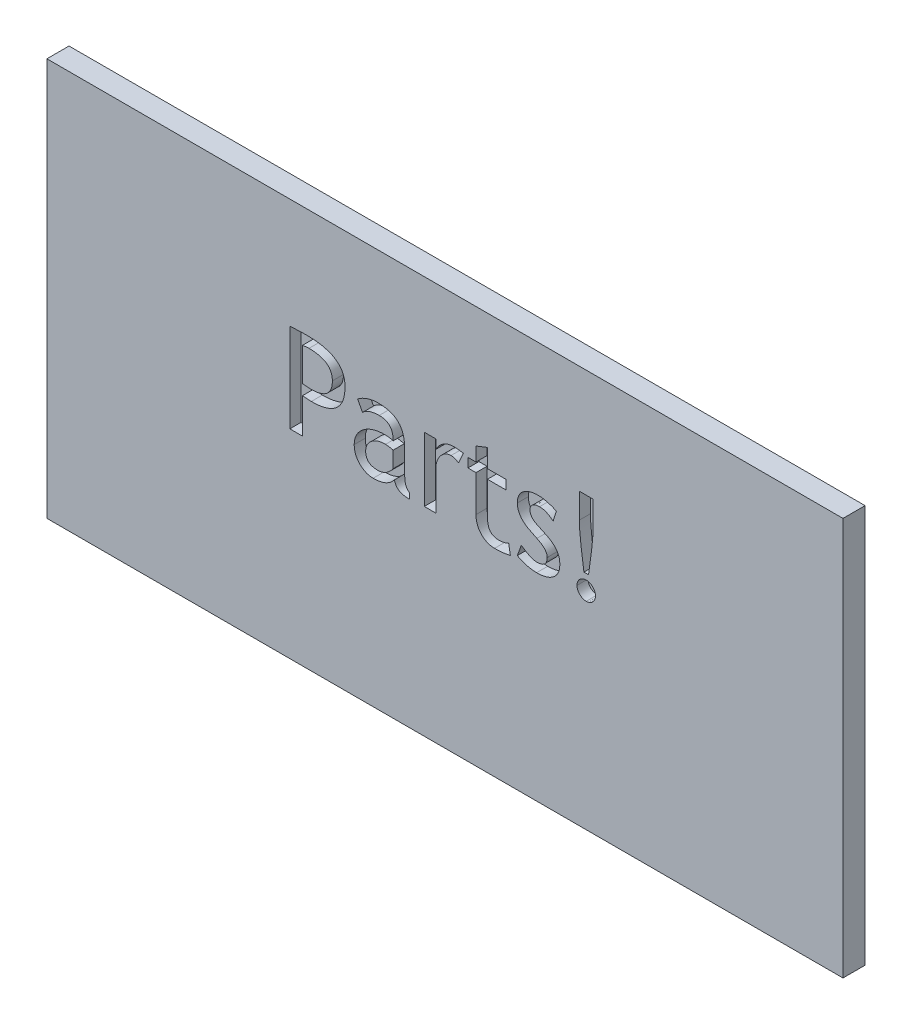
from build123d import *

# Parameters (mm, degrees)
SKETCH1_W           = 914.4
SKETCH1_H           = 457.2
BOSS_EXTRUDE1_DEPTH = 25.4
CUT_EXTRUDE1_DEPTH  = 12.7


with BuildPart() as part:
    # Sketch1 → Boss-Extrude1 (new body)
    with BuildSketch(Plane.XY):
        Rectangle(SKETCH1_W, SKETCH1_H)
    extrude(amount=BOSS_EXTRUDE1_DEPTH)

    # Sketch2 → Cut-Extrude1 (cut)
    # profile 1 of 7: a face of its own
    with BuildSketch(Plane.XY.offset(25.4)):
        with BuildLine():
            Line((-163.615584416, 40.28538961), (-163.615584416, 0))
            Line((-163.615584416, 0), (-178.12987013, 0))
            Line((-178.12987013, 0), (-178.12987013, 102.218506494))
            add(Edge.make_bspline(
                [(-178.12987013, 102.218506494), (-176.879121954, 102.27366981), (-174.508247341, 102.37823547), (-171.15458288, 102.523319863), (-168.192539103, 102.643966244), (-165.62295261, 102.760663715), (-163.436517225, 102.803198457), (-161.643762274, 102.885891383), (-160.241181936, 102.893415534), (-159.437211969, 102.911786323), (-159.100487013, 102.919480519)],
                knots=[0, 0, 0, 0, 1.577853808, 2.99092464, 4.230560714, 5.314071883, 6.232522799, 6.986491855, 7.575514634, 8, 8, 8, 8], degree=3))
            add(Edge.make_bspline(
                [(-159.100487013, 102.919480519), (-157.313276247, 102.892987063), (-153.845682191, 102.841583752), (-148.819918078, 102.52538382), (-144.139820894, 101.946365157), (-139.804976334, 101.155792858), (-135.808587288, 100.123633049), (-132.145402028, 98.890327417), (-128.851053451, 97.364924482), (-125.869313516, 95.6695841), (-123.263927259, 93.695397743), (-120.975749497, 91.521033581), (-119.072883939, 89.07938071), (-117.482589102, 86.429697125), (-116.290131415, 83.525560622), (-115.426730076, 80.404765136), (-114.872736968, 77.058039718), (-114.821196948, 74.745305359), (-114.794805195, 73.561038961)],
                knots=[0, 0, 0, 0, 1.423919344, 2.762726338, 4.009571971, 5.179014362, 6.27060433, 7.295643458, 8.253560935, 9.158834423, 10.022816685, 10.851466544, 11.666382283, 12.481426763, 13.306069473, 14.158929247, 15.057255227, 16, 16, 16, 16], degree=3))
            add(Edge.make_bspline(
                [(-114.794805195, 73.561038961), (-114.818935661, 72.185251497), (-114.865650066, 69.521851183), (-115.327152429, 65.657299221), (-116.084859429, 62.06147442), (-117.129494616, 58.717850878), (-118.491687817, 55.640846292), (-120.18110912, 52.840467459), (-122.13638298, 50.278094722), (-124.441297825, 48.016967471), (-127.02223831, 46.005911574), (-129.927117107, 44.291130049), (-133.111578317, 42.826777099), (-136.600450006, 41.632330534), (-140.38958188, 40.708602079), (-144.486429512, 40.068271998), (-148.879107442, 39.638041367), (-151.910971039, 39.602642477), (-153.472077922, 39.584415584)],
                knots=[0, 0, 0, 0, 1.119012572, 2.166307307, 3.161006299, 4.105347886, 5.011469497, 5.891793109, 6.760820887, 7.626730921, 8.511447675, 9.416706231, 10.364930173, 11.358732919, 12.412486159, 13.53399667, 14.730254627, 16, 16, 16, 16], degree=3))
            add(Edge.make_bspline(
                [(-153.472077922, 39.584415584), (-153.691964193, 39.592067692), (-154.19352603, 39.609522192), (-155.032963235, 39.618355651), (-156.042620907, 39.691147587), (-157.223730047, 39.778869028), (-158.579543416, 39.847101998), (-160.103946042, 39.982208595), (-161.801549778, 40.12428583), (-162.990249649, 40.229853849), (-163.615584416, 40.28538961)],
                knots=[0, 0, 0, 0, 0.519235843, 1.184379918, 1.980559897, 2.90727091, 3.979636347, 5.183721872, 6.518451402, 8, 8, 8, 8], degree=3))
        make_face()
        with BuildLine():
            Line((-163.615584416, 90.343181818), (-163.615584416, 52.160714286))
            add(Edge.make_bspline(
                [(-163.615584416, 52.160714286), (-162.942124492, 52.105403661), (-161.677680481, 52.001556074), (-159.904358583, 51.860872212), (-158.38686254, 51.726702403), (-157.120471946, 51.655764481), (-156.110819631, 51.573549935), (-155.356221419, 51.496243058), (-154.852799353, 51.490128885), (-154.605960777, 51.467347265), (-154.523538961, 51.45974026)],
                knots=[0, 0, 0, 0, 1.77832381, 3.338863697, 4.681619775, 5.787235154, 6.676397059, 7.347775098, 7.782215722, 8, 8, 8, 8], degree=3))
            add(Edge.make_bspline(
                [(-154.523538961, 51.45974026), (-153.505781104, 51.473837586), (-151.528950848, 51.501219365), (-148.666606474, 51.76131145), (-145.993920741, 52.128351351), (-143.531776821, 52.720940223), (-141.254063638, 53.425951628), (-139.176302361, 54.320450336), (-137.2869354, 55.364755628), (-135.610665044, 56.597519681), (-134.096956846, 57.957063005), (-132.825810462, 59.523362551), (-131.715287627, 61.221807967), (-130.826352633, 63.095414719), (-130.151817599, 65.133719784), (-129.654614586, 67.328414073), (-129.370578205, 69.684506294), (-129.329945249, 71.30617403), (-129.309090909, 72.138474026)],
                knots=[0, 0, 0, 0, 1.309170541, 2.542852328, 3.695843429, 4.776838986, 5.797565881, 6.760101477, 7.682524874, 8.56863165, 9.432306229, 10.292760922, 11.15611858, 12.038112649, 12.952490574, 13.913522175, 14.929142236, 16, 16, 16, 16], degree=3))
            add(Edge.make_bspline(
                [(-129.309090909, 72.138474026), (-129.32812298, 72.902319017), (-129.365153168, 74.388511723), (-129.674350306, 76.548101113), (-130.207491113, 78.555662071), (-130.961868834, 80.415176566), (-131.904405436, 82.134374452), (-133.076188534, 83.696937466), (-134.450393614, 85.106389727), (-136.027095914, 86.381220077), (-137.84634065, 87.460023602), (-139.845015403, 88.441879602), (-142.078743908, 89.231649287), (-144.499954676, 89.916486475), (-147.142802925, 90.42179269), (-149.985429933, 90.794633553), (-153.043327633, 90.988585893), (-155.148687877, 91.025245135), (-156.23474026, 91.044155844)],
                knots=[0, 0, 0, 0, 0.979831033, 1.906430954, 2.792007294, 3.638616229, 4.475432108, 5.300832925, 6.136486397, 6.995858543, 7.894207126, 8.844710668, 9.848998133, 10.929490732, 12.070915545, 13.298158202, 14.606251956, 16, 16, 16, 16], degree=3))
            add(Edge.make_bspline(
                [(-156.23474026, 91.044155844), (-156.72282765, 91.034420997), (-157.789612221, 91.0131441), (-159.50999624, 90.885895992), (-161.481339755, 90.648029815), (-162.87377707, 90.449138969), (-163.615584416, 90.343181818)],
                knots=[0, 0, 0, 0, 0.789391293, 1.725327202, 2.78819034, 4, 4, 4, 4], degree=3))
        make_face(mode=Mode.SUBTRACT)
    # profile 2 of 7: a face of its own
    with BuildSketch(Plane.XY.offset(25.4)):
        with BuildLine():
            add(Edge.make_bspline(
                [(-58.118993506, 9.236363636), (-58.804551384, 8.390969175), (-60.165490115, 6.712730031), (-62.59368798, 4.570272111), (-65.256561347, 2.724521622), (-68.204932545, 1.24720517), (-71.408244512, 0.084420221), (-74.874587923, -0.729903565), (-78.604283679, -1.232709137), (-81.180751079, -1.289967336), (-82.508766234, -1.319480519)],
                knots=[0, 0, 0, 0, 0.944960127, 1.875892434, 2.804059133, 3.755402226, 4.734562172, 5.760675535, 6.845761903, 8, 8, 8, 8], degree=3))
            add(Edge.make_bspline(
                [(-82.508766234, -1.319480519), (-83.231683627, -1.301068723), (-84.656810028, -1.264772546), (-86.75281686, -0.934313597), (-88.791553228, -0.454753314), (-90.745523747, 0.281848663), (-92.638957142, 1.184543132), (-94.434505951, 2.318025602), (-96.184392827, 3.613506596), (-97.808851863, 5.132738767), (-99.309136558, 6.792379574), (-100.63834414, 8.56718545), (-101.751324783, 10.450090656), (-102.674009449, 12.428460625), (-103.370357091, 14.512177049), (-103.857745603, 16.689146984), (-104.185321253, 18.957676716), (-104.220814083, 20.505739025), (-104.238961039, 21.29724026)],
                knots=[0, 0, 0, 0, 0.993455545, 1.95845298, 2.911997968, 3.868815737, 4.82409202, 5.79181603, 6.784147119, 7.814064514, 8.844588789, 9.85771863, 10.857760396, 11.847207058, 12.854368548, 13.872291747, 14.912134415, 16, 16, 16, 16], degree=3))
            add(Edge.make_bspline(
                [(-104.238961039, 21.29724026), (-104.204429156, 22.247205575), (-104.136467287, 24.11682322), (-103.683103321, 26.863477775), (-102.880315854, 29.487511837), (-101.79723299, 32.008470584), (-100.362301544, 34.402853971), (-98.651113542, 36.697720435), (-96.613300063, 38.869809881), (-94.284659654, 40.894518554), (-91.737468724, 42.764221485), (-88.965030253, 44.373960211), (-86.040699138, 45.766893377), (-82.924878614, 46.866845909), (-79.663198779, 47.768383511), (-76.218240764, 48.373318152), (-72.607546914, 48.753730633), (-70.139627112, 48.798133891), (-68.881006494, 48.820779221)],
                knots=[0, 0, 0, 0, 0.914144162, 1.799118376, 2.669442492, 3.549088249, 4.432603435, 5.349184236, 6.299014847, 7.292526244, 8.315019686, 9.334664862, 10.373010545, 11.427301971, 12.510180587, 13.625743326, 14.789146875, 16, 16, 16, 16], degree=3))
            add(Edge.make_bspline(
                [(-68.881006494, 48.820779221), (-68.158778987, 48.803730344), (-66.662327883, 48.768405173), (-64.355957833, 48.505277427), (-61.905722307, 48.092013098), (-60.240609357, 47.703097433), (-59.376623377, 47.501298701)],
                knots=[0, 0, 0, 0, 0.901025355, 1.866919186, 2.893197055, 4, 4, 4, 4], degree=3))
            add(Edge.make_bspline(
                [(-59.376623377, 47.501298701), (-59.388317989, 48.195713502), (-59.410941648, 49.539084646), (-59.589926086, 51.492015391), (-59.928846057, 53.300484817), (-60.346792798, 54.99221497), (-60.932575602, 56.53218503), (-61.608923485, 57.959177683), (-62.435468796, 59.239867833), (-63.396703812, 60.382812972), (-64.470244382, 61.411115889), (-65.700674282, 62.263864963), (-67.029118473, 63.028650826), (-68.500541248, 63.607459825), (-70.082165289, 64.09829581), (-71.798998767, 64.409821101), (-73.637854508, 64.628364356), (-74.907291553, 64.645647182), (-75.560876623, 64.654545455)],
                knots=[0, 0, 0, 0, 1.232010569, 2.38337006, 3.473922505, 4.494186629, 5.47029199, 6.391873334, 7.29149648, 8.165725792, 9.03688882, 9.919916482, 10.815232808, 11.75034576, 12.71849901, 13.749128771, 14.841111628, 16, 16, 16, 16], degree=3))
            add(Edge.make_bspline(
                [(-75.560876623, 64.654545455), (-76.565066872, 64.635775608), (-78.523454469, 64.599170358), (-81.371158751, 64.285730327), (-84.042515408, 63.777889311), (-86.534748523, 63.053196163), (-88.853438682, 62.130108785), (-90.989719984, 60.989802365), (-92.954492735, 59.647096738), (-94.114023397, 58.586856482), (-94.693344156, 58.057142857)],
                knots=[0, 0, 0, 0, 1.160376748, 2.26298496, 3.306713365, 4.299604534, 5.258357027, 6.185834306, 7.093612716, 8, 8, 8, 8], degree=3))
            Line((-94.693344156, 58.057142857), (-100.280519481, 68.612987013))
            add(Edge.make_bspline(
                [(-100.280519481, 68.612987013), (-99.604560084, 69.151241085), (-98.187463536, 70.279649081), (-95.730855172, 71.719982014), (-92.936257847, 73.058160886), (-89.854459797, 74.249085549), (-86.627709247, 75.232049855), (-83.402298085, 75.993995848), (-80.239806223, 76.440672792), (-78.153033941, 76.500483766), (-77.12775974, 76.52987013)],
                knots=[0, 0, 0, 0, 0.83233406, 1.744923925, 2.737828223, 3.818310257, 4.927193929, 5.988133053, 7.011528333, 8, 8, 8, 8], degree=3))
            add(Edge.make_bspline(
                [(-77.12775974, 76.52987013), (-75.821220001, 76.506088641), (-73.292543573, 76.460061957), (-69.640236163, 76.109067041), (-66.262081502, 75.536718743), (-63.155220697, 74.74894727), (-60.33158665, 73.689788386), (-57.779087165, 72.41735598), (-55.499383213, 70.901277266), (-53.501125459, 69.126921781), (-51.746238523, 67.108047962), (-50.256869132, 64.801680846), (-48.978860678, 62.245660354), (-47.948100595, 59.407307568), (-47.151228706, 56.299483354), (-46.579661025, 52.920771617), (-46.257603101, 49.266844882), (-46.207686236, 46.745979905), (-46.181818182, 45.43961039)],
                knots=[0, 0, 0, 0, 1.2352911, 2.390781845, 3.465517746, 4.472669273, 5.416533714, 6.311624893, 7.164115709, 7.997342812, 8.831177852, 9.685499483, 10.586398193, 11.528000591, 12.535152118, 13.616293066, 14.7647089, 16, 16, 16, 16], degree=3))
            Line((-46.181818182, 45.43961039), (-46.181818182, 18.472727273))
            add(Edge.make_bspline(
                [(-46.181818182, 18.472727273), (-46.167425523, 17.68170691), (-46.139814194, 16.164188559), (-45.891867346, 13.990529498), (-45.487670896, 12.019937146), (-44.913976057, 10.252497442), (-44.172719466, 8.68676798), (-43.257490454, 7.330413377), (-42.18056334, 6.165442541), (-41.328150505, 5.572857556), (-40.903896104, 5.277922078)],
                knots=[0, 0, 0, 0, 1.279077697, 2.453822896, 3.53296146, 4.527738333, 5.452481132, 6.324974507, 7.166323045, 8, 8, 8, 8], degree=3))
            Line((-40.903896104, 5.277922078), (-40.903896104, -1.319480519))
            add(Edge.make_bspline(
                [(-40.903896104, -1.319480519), (-42.122347332, -1.300488782), (-44.405038252, -1.26490897), (-47.586998347, -0.783427919), (-50.303387249, -0.055114176), (-52.579706693, 1.031701533), (-54.448080018, 2.52115413), (-55.986140704, 4.392931156), (-57.234045055, 6.665802136), (-57.814886365, 8.353005845), (-58.118993506, 9.236363636)],
                knots=[0, 0, 0, 0, 1.322927942, 2.4784214, 3.487862418, 4.369631662, 5.198919122, 6.063344162, 6.986038252, 8, 8, 8, 8], degree=3))
        make_face()
        with BuildLine():
            add(Edge.make_bspline(
                [(-59.376623377, 38.264935065), (-60.344438217, 38.463975843), (-62.12465354, 38.830094885), (-64.565832411, 39.237315236), (-66.53819186, 39.517594636), (-67.698357811, 39.564226438), (-68.200649351, 39.584415584)],
                knots=[0, 0, 0, 0, 1.327096202, 2.441083662, 3.325070274, 4, 4, 4, 4], degree=3))
            add(Edge.make_bspline(
                [(-68.200649351, 39.584415584), (-69.025818615, 39.568594706), (-70.638792166, 39.537669343), (-72.99959102, 39.295794724), (-75.234306128, 38.84788), (-77.368361767, 38.289153687), (-79.37288598, 37.516022334), (-81.270109384, 36.587168638), (-83.035032735, 35.467452743), (-84.685316595, 34.220702948), (-86.15598966, 32.839923583), (-87.4676748, 31.402348598), (-88.564970216, 29.883010247), (-89.484334452, 28.31450051), (-90.185864059, 26.678893076), (-90.691350443, 24.985226983), (-90.980579217, 23.22457312), (-91.022802393, 22.026726419), (-91.044155844, 21.420941558)],
                knots=[0, 0, 0, 0, 1.220287638, 2.385318708, 3.503525747, 4.58834872, 5.643485871, 6.675260618, 7.707335663, 8.72980793, 9.729394515, 10.686538231, 11.60338903, 12.495920083, 13.370033194, 14.228646617, 15.104176635, 16, 16, 16, 16], degree=3))
            add(Edge.make_bspline(
                [(-91.044155844, 21.420941558), (-91.014091567, 20.461000685), (-90.957234776, 18.645585057), (-90.282288006, 16.119705818), (-89.202005669, 13.960908326), (-87.645025398, 12.19826576), (-85.648576215, 10.830451172), (-83.21334697, 9.898407439), (-80.371137433, 9.318332195), (-78.333569516, 9.264795711), (-77.251461039, 9.236363636)],
                knots=[0, 0, 0, 0, 1.090937083, 2.063152309, 2.952441297, 3.817735852, 4.712383707, 5.68197955, 6.768949218, 8, 8, 8, 8], degree=3))
            add(Edge.make_bspline(
                [(-77.251461039, 9.236363636), (-76.417349907, 9.26722146), (-74.761701466, 9.328471941), (-72.320547691, 9.848664269), (-69.955343377, 10.674696447), (-67.670211969, 11.844750781), (-65.470036358, 13.350764384), (-63.343589508, 15.183496931), (-61.269300397, 17.329742072), (-60.020643334, 18.954306211), (-59.376623377, 19.792207792)],
                knots=[0, 0, 0, 0, 0.926994493, 1.840014991, 2.763567446, 3.707150477, 4.686710869, 5.722325487, 6.825243626, 8, 8, 8, 8], degree=3))
            Line((-59.376623377, 19.792207792), (-59.376623377, 38.264935065))
        make_face(mode=Mode.SUBTRACT)
    # profile 3 of 7: a face of its own
    with BuildSketch(Plane.XY.offset(25.4)):
        with BuildLine():
            add(Edge.make_bspline(
                [(15.627597403, 62.984577922), (14.916713947, 63.436825565), (13.540321602, 64.3124546), (11.359035639, 65.272302654), (9.157720528, 65.864537515), (7.679833926, 65.937761003), (6.94788961, 65.974025974)],
                knots=[0, 0, 0, 0, 1.083912525, 2.09864063, 3.058324786, 4, 4, 4, 4], degree=3))
            add(Edge.make_bspline(
                [(6.94788961, 65.974025974), (6.36921217, 65.954702119), (5.224039598, 65.916461213), (3.540216147, 65.595839065), (1.914036887, 65.074458614), (0.342524355, 64.348094121), (-1.179846885, 63.414795684), (-2.615043829, 62.239099042), (-4.029181872, 60.900797622), (-5.346897659, 59.357628343), (-6.589092907, 57.693052931), (-7.621149118, 55.884259357), (-8.557604206, 54.026728353), (-9.256667271, 52.058948912), (-9.852236444, 50.025433519), (-10.254841036, 47.898920512), (-10.510709472, 45.68642947), (-10.540644109, 44.18270756), (-10.555844156, 43.419155844)],
                knots=[0, 0, 0, 0, 0.879821936, 1.741121875, 2.597521335, 3.47235911, 4.368980926, 5.306256831, 6.289802627, 7.327487782, 8.389847235, 9.44425347, 10.491690238, 11.550235473, 12.6158827, 13.712920077, 14.838679022, 16, 16, 16, 16], degree=3))
            Line((-10.555844156, 43.419155844), (-10.555844156, 0))
            Line((-10.555844156, 0), (-23.750649351, 0))
            Line((-23.750649351, 0), (-23.750649351, 73.890909091))
            Line((-23.750649351, 73.890909091), (-10.555844156, 73.890909091))
            Line((-10.555844156, 73.890909091), (-10.555844156, 63.335064935))
            add(Edge.make_bspline(
                [(-10.555844156, 63.335064935), (-9.94103353, 64.381923602), (-8.74845061, 66.412574527), (-6.602581655, 69.118459497), (-4.238577006, 71.41612363), (-1.635412372, 73.295158581), (1.195071073, 74.749881333), (4.243496136, 75.785980772), (7.505954358, 76.418514239), (9.755774054, 76.492191567), (10.906331169, 76.52987013)],
                knots=[0, 0, 0, 0, 1.095181229, 2.124384928, 3.107413611, 4.063213658, 5.012363421, 5.969994755, 6.961855929, 8, 8, 8, 8], degree=3))
            add(Edge.make_bspline(
                [(10.906331169, 76.52987013), (11.559437719, 76.507485588), (13.005427831, 76.457925795), (15.368484782, 76.253763728), (18.112872348, 75.835075703), (20.067592488, 75.508518462), (21.111688312, 75.334090909)],
                knots=[0, 0, 0, 0, 0.762334318, 1.687822431, 2.764971572, 4, 4, 4, 4], degree=3))
            Line((21.111688312, 75.334090909), (15.627597403, 62.984577922))
        make_face()
    # profile 4 of 7: a face of its own
    with BuildSketch(Plane.XY.offset(25.4)):
        with BuildLine():
            Line((35.625974026, 63.335064935), (26.38961039, 63.335064935))
            Line((26.38961039, 63.335064935), (26.38961039, 73.890909091))
            Line((26.38961039, 73.890909091), (35.625974026, 73.890909091))
            Line((35.625974026, 73.890909091), (35.625974026, 89.807142857))
            Line((35.625974026, 89.807142857), (48.820779221, 95.002597403))
            Line((48.820779221, 95.002597403), (48.820779221, 73.890909091))
            Line((48.820779221, 73.890909091), (69.932467532, 73.890909091))
            Line((69.932467532, 73.890909091), (69.932467532, 63.335064935))
            Line((69.932467532, 63.335064935), (48.820779221, 63.335064935))
            Line((48.820779221, 63.335064935), (48.820779221, 26.492694805))
            add(Edge.make_bspline(
                [(48.820779221, 26.492694805), (48.824122793, 25.743183194), (48.830604293, 24.290258195), (49.009242716, 22.19967183), (49.241285489, 20.276195739), (49.594995727, 18.525872036), (50.041985685, 16.937381673), (50.590952415, 15.509421522), (51.25458392, 14.255409564), (52.025266257, 13.167688736), (52.905909778, 12.225468378), (53.901412003, 11.402928587), (55.052752124, 10.759962375), (56.295385658, 10.189851131), (57.667561201, 9.761668061), (59.159228331, 9.455979347), (60.77382971, 9.268725989), (61.891362006, 9.247393235), (62.469155844, 9.236363636)],
                knots=[0, 0, 0, 0, 1.412375387, 2.737883543, 3.952723546, 5.06303916, 6.100522586, 7.060446298, 7.941412932, 8.768226801, 9.565694039, 10.366940763, 11.191315048, 12.043716813, 12.941012141, 13.893828134, 14.911053281, 16, 16, 16, 16], degree=3))
            add(Edge.make_bspline(
                [(62.469155844, 9.236363636), (63.344323237, 9.268657108), (65.12190543, 9.334249474), (67.802788191, 9.865429156), (70.532443931, 10.675870268), (72.304494302, 11.469525197), (73.210551948, 11.875324675)],
                knots=[0, 0, 0, 0, 0.941382402, 1.912073746, 2.932433537, 4, 4, 4, 4], degree=3))
            Line((73.210551948, 11.875324675), (75.21038961, 0.680357143))
            add(Edge.make_bspline(
                [(75.21038961, 0.680357143), (73.790950693, 0.374985539), (70.905062623, -0.245871235), (66.429566841, -0.878372546), (61.754024183, -1.250240075), (58.566390206, -1.296124553), (56.943831169, -1.319480519)],
                knots=[0, 0, 0, 0, 0.94587189, 1.923070004, 2.942807876, 4, 4, 4, 4], degree=3))
            add(Edge.make_bspline(
                [(56.943831169, -1.319480519), (56.207171893, -1.301292583), (54.761497587, -1.26559924), (52.64458109, -0.936216192), (50.604960837, -0.457863303), (48.665018785, 0.281542309), (46.794576518, 1.187486393), (45.015675959, 2.304581365), (43.336705435, 3.63955705), (41.765690366, 5.153675139), (40.320360127, 6.816748017), (39.066518815, 8.608192422), (37.999353464, 10.506165466), (37.137877473, 12.512455255), (36.448482538, 14.621802983), (35.982205555, 16.848205789), (35.687616782, 19.172683972), (35.646713041, 20.760304407), (35.625974026, 21.56525974)],
                knots=[0, 0, 0, 0, 1.011657449, 1.985350936, 2.938256691, 3.885576537, 4.83171868, 5.790782512, 6.765757656, 7.774368669, 8.785452854, 9.788965921, 10.774179575, 11.772479321, 12.784974034, 13.818611436, 14.893992343, 16, 16, 16, 16], degree=3))
            Line((35.625974026, 21.56525974), (35.625974026, 63.335064935))
        make_face()
    # profile 5 of 7: a face of its own
    with BuildSketch(Plane.XY.offset(25.4)):
        with BuildLine():
            Line((83.127272727, 4.556331169), (87.724837662, 17.153246753))
            add(Edge.make_bspline(
                [(87.724837662, 17.153246753), (88.613040508, 16.527062467), (90.319412695, 15.324067615), (92.858304948, 13.714883221), (95.253225878, 12.340073072), (97.523179885, 11.218557615), (99.665385206, 10.344840458), (101.670714679, 9.719435344), (103.542509284, 9.316203285), (104.752619707, 9.262202795), (105.331655844, 9.236363636)],
                knots=[0, 0, 0, 0, 1.332253382, 2.559460521, 3.683996021, 4.716505285, 5.661560423, 6.517070436, 7.290420287, 8, 8, 8, 8], degree=3))
            add(Edge.make_bspline(
                [(105.331655844, 9.236363636), (106.282716885, 9.263041999), (108.069006449, 9.313149489), (110.562412215, 9.80903609), (112.70007765, 10.613094326), (114.436267153, 11.820932304), (115.813563776, 13.351050613), (116.756363607, 15.238555644), (117.353041261, 17.440412186), (117.405811061, 19.018209322), (117.433766234, 19.854058442)],
                knots=[0, 0, 0, 0, 1.237415283, 2.324122124, 3.296572087, 4.190537608, 5.052884192, 5.949713559, 6.91384635, 8, 8, 8, 8], degree=3))
            add(Edge.make_bspline(
                [(117.433766234, 19.854058442), (117.398842306, 20.483750987), (117.329128356, 21.74072172), (116.733096871, 23.575411174), (115.784947701, 25.329335575), (114.464160228, 27.011469633), (112.763690616, 28.594833282), (110.720260619, 30.13091953), (108.296765341, 31.589554588), (106.514460465, 32.451941416), (105.579058442, 32.904545455)],
                knots=[0, 0, 0, 0, 0.810114072, 1.617122017, 2.46134648, 3.37043313, 4.360517749, 5.448424735, 6.660863975, 8, 8, 8, 8], degree=3))
            add(Edge.make_bspline(
                [(105.579058442, 32.904545455), (104.848603359, 33.237106816), (103.443931148, 33.876625541), (101.452808519, 34.86443271), (99.612085107, 35.725438005), (97.991062118, 36.58630921), (96.540065484, 37.34147626), (95.282004136, 38.042662563), (94.206721605, 38.677878943), (92.508136231, 39.784222606), (90.281853656, 41.537677953), (88.121006631, 43.736958297), (86.67282752, 45.638059502), (85.698700399, 47.082729609), (84.935586447, 48.598944143), (84.247448661, 50.127500755), (83.765155609, 51.738812577), (83.385923755, 53.389650418), (83.183243618, 55.110893607), (83.14618491, 56.269891728), (83.127272727, 56.861363636)],
                knots=[0, 0, 0, 0, 1.23709491, 2.378945513, 3.426052076, 4.368942052, 5.207711754, 5.94752138, 6.588849952, 7.132436911, 9.071528894, 10.94447031, 11.866174453, 12.753511042, 13.625345716, 14.47942911, 15.333840934, 16.212854489, 17.08796542, 18, 18, 18, 18], degree=3))
            add(Edge.make_bspline(
                [(83.127272727, 56.861363636), (83.147190158, 57.611301859), (83.186287852, 59.083422241), (83.488975178, 61.231180359), (84.040806298, 63.242238779), (84.745811834, 65.139327048), (85.721068246, 66.884909073), (86.868360627, 68.522105344), (88.249959091, 70.014861848), (89.818774774, 71.377636301), (91.563851417, 72.577335637), (93.440319912, 73.638629205), (95.440572343, 74.558226606), (97.592460857, 75.256109785), (99.851820888, 75.85732299), (102.250591037, 76.223815028), (104.769130509, 76.487578775), (106.492317983, 76.515569259), (107.372727273, 76.52987013)],
                knots=[0, 0, 0, 0, 1.022782438, 2.007710539, 2.949032681, 3.862933841, 4.760636158, 5.668315145, 6.583849215, 7.527362271, 8.497233202, 9.466877628, 10.465273033, 11.4938377, 12.548717365, 13.650528614, 14.799610336, 16, 16, 16, 16], degree=3))
            add(Edge.make_bspline(
                [(107.372727273, 76.52987013), (108.07408837, 76.510542328), (109.528171492, 76.470471342), (111.783260433, 76.244337585), (114.16344182, 75.807200114), (116.690473838, 75.291109703), (119.323441771, 74.54748142), (122.097181065, 73.683436097), (125.005924296, 72.650491413), (126.975144596, 71.863529227), (127.98961039, 71.458116883)],
                knots=[0, 0, 0, 0, 0.788423695, 1.634583945, 2.543753211, 3.507206369, 4.532133891, 5.616758026, 6.772246325, 8, 8, 8, 8], degree=3))
            Line((127.98961039, 71.458116883), (124.278571429, 59.376623377))
            add(Edge.make_bspline(
                [(124.278571429, 59.376623377), (123.639662829, 59.901177832), (122.393559791, 60.924248897), (120.445507278, 62.273160679), (118.490317311, 63.402398494), (116.538745546, 64.349080451), (114.582536805, 65.06730381), (112.624342574, 65.592571912), (110.661445895, 65.913251166), (109.346224755, 65.953841642), (108.692207792, 65.974025974)],
                knots=[0, 0, 0, 0, 1.147535307, 2.238109229, 3.285624631, 4.280117791, 5.246232794, 6.174419652, 7.092197899, 8, 8, 8, 8], degree=3))
            add(Edge.make_bspline(
                [(108.692207792, 65.974025974), (107.94070039, 65.949126789), (106.492878509, 65.901157087), (104.413778266, 65.45282705), (102.513527349, 64.735147807), (100.840519451, 63.727633186), (99.415463193, 62.538765414), (98.398542524, 61.118379465), (97.757665994, 59.544644853), (97.680601469, 58.434182146), (97.641558442, 57.871590909)],
                knots=[0, 0, 0, 0, 1.185623905, 2.284172091, 3.342513114, 4.379428126, 5.356672626, 6.251331621, 7.114076051, 8, 8, 8, 8], degree=3))
            add(Edge.make_bspline(
                [(97.641558442, 57.871590909), (97.662496807, 57.271366578), (97.703645024, 56.091801713), (98.112264057, 54.387309098), (98.753710983, 52.799024712), (99.658888624, 51.328126288), (100.832935045, 49.984932591), (102.245244327, 48.742846842), (103.917586867, 47.617641585), (105.158780098, 46.999089528), (105.805844156, 46.676623377)],
                knots=[0, 0, 0, 0, 0.977472815, 1.920936105, 2.840937217, 3.761757322, 4.723421608, 5.73989644, 6.821753339, 8, 8, 8, 8], degree=3))
            Line((105.805844156, 46.676623377), (115.28961039, 42.223376623))
            add(Edge.make_bspline(
                [(115.28961039, 42.223376623), (116.659141253, 41.565198098), (119.266735843, 40.312022424), (122.745173201, 38.07231076), (125.657130769, 35.719234406), (128.017848789, 33.195897579), (129.797580535, 30.390085222), (131.0687376, 27.29625529), (131.817176926, 23.868437159), (131.903474689, 21.479690464), (131.948051948, 20.245779221)],
                knots=[0, 0, 0, 0, 1.237288181, 2.355803767, 3.362588053, 4.282183816, 5.158430962, 6.054936231, 6.995273942, 8, 8, 8, 8], degree=3))
            add(Edge.make_bspline(
                [(131.948051948, 20.245779221), (131.930371631, 19.426925759), (131.895749927, 17.823441994), (131.562997781, 15.485683859), (130.997093011, 13.285975791), (130.249967195, 11.202414974), (129.217248066, 9.290351647), (128.025745091, 7.481533243), (126.556365931, 5.859208989), (124.911970152, 4.344165543), (123.052573555, 3.009636957), (121.015846166, 1.854202605), (118.824071394, 0.859793884), (116.455882167, 0.052792746), (113.913338789, -0.553425628), (111.207251141, -1.008886535), (108.326666145, -1.280006297), (106.349347947, -1.306067342), (105.331655844, -1.319480519)],
                knots=[0, 0, 0, 0, 1.013777327, 1.985184849, 2.916226153, 3.823782774, 4.71851635, 5.601431018, 6.499841238, 7.421654792, 8.366598766, 9.327319825, 10.317745587, 11.343281881, 12.420902297, 13.551539906, 14.739819163, 16, 16, 16, 16], degree=3))
            add(Edge.make_bspline(
                [(105.331655844, -1.319480519), (104.354935084, -1.307666816), (102.41083108, -1.28415235), (99.521098162, -0.970626176), (96.674190713, -0.531883871), (93.873167903, 0.119191637), (91.115094869, 0.935475665), (88.400449752, 1.96183926), (85.719220447, 3.141248049), (83.993745514, 4.083277254), (83.127272727, 4.556331169)],
                knots=[0, 0, 0, 0, 1.00869075, 2.007738347, 3.000000303, 3.983534981, 4.976508054, 5.969633443, 6.980421369, 8, 8, 8, 8], degree=3))
        make_face()
    # profile 6 of 7: a face of its own
    with BuildSketch(Plane.XY.offset(25.4)):
        with BuildLine():
            Line((164.935064935, 26.38961039), (159.657142857, 26.38961039))
            add(Edge.make_bspline(
                [(159.657142857, 26.38961039), (159.442912362, 27.832617745), (159.022731622, 30.662858592), (158.425060927, 34.827543394), (157.869701562, 38.820559636), (157.352385886, 42.641334637), (156.875838268, 46.297156729), (156.445940015, 49.788718755), (156.051466178, 53.114648571), (155.702502978, 56.262399535), (155.38934428, 59.244668496), (155.123499192, 62.055760975), (154.89434857, 64.70151558), (154.708113765, 67.175656207), (154.56236701, 69.484877113), (154.458859955, 71.629230718), (154.392887726, 73.601856227), (154.383623912, 74.859858125), (154.379220779, 75.457792208)],
                knots=[0, 0, 0, 0, 1.417929695, 2.781054806, 4.089398624, 5.33636768, 6.52860727, 7.67278039, 8.755668264, 9.78394529, 10.751020575, 11.670244546, 12.528392259, 13.33220255, 14.081784097, 14.777271002, 15.418831289, 16, 16, 16, 16], degree=3))
            Line((154.379220779, 75.457792208), (154.379220779, 104.238961039))
            Line((154.379220779, 104.238961039), (170.212987013, 104.238961039))
            Line((170.212987013, 104.238961039), (170.212987013, 75.519642857))
            add(Edge.make_bspline(
                [(170.212987013, 75.519642857), (170.20859261, 74.935451709), (170.199336377, 73.704929672), (170.132772693, 71.766688425), (170.0298214, 69.649807815), (169.884191625, 67.361188591), (169.696592958, 64.900913781), (169.470306962, 62.268650272), (169.199927529, 59.458001911), (168.891716816, 56.475230861), (168.538815424, 53.314167239), (168.148246849, 49.980910284), (167.714699694, 46.476047435), (167.238549597, 42.799577954), (166.722783981, 38.944234042), (166.167219656, 34.910013028), (165.569614003, 30.704085173), (165.149315763, 27.846361082), (164.935064935, 26.38961039)],
                knots=[0, 0, 0, 0, 0.567120604, 1.194565175, 1.882543532, 2.624556161, 3.420737397, 4.277842758, 5.189308699, 6.16184521, 7.188873236, 8.277071626, 9.419854973, 10.617262638, 11.875941229, 13.195912857, 14.570591227, 16, 16, 16, 16], degree=3))
        make_face()
    # profile 7 of 7: a face of its own
    with BuildSketch(Plane.XY.offset(25.4)):
        with BuildLine():
            add(Edge.make_bspline(
                [(162.296103896, 19.792207792), (163.001113209, 19.759361745), (164.388026155, 19.694746132), (166.3800715, 19.098116272), (168.199002866, 18.098629781), (169.79350184, 16.741883418), (171.164382396, 15.157589401), (172.152315008, 13.345745412), (172.757458861, 11.363751856), (172.820002963, 9.982888546), (172.851948052, 9.277597403)],
                knots=[0, 0, 0, 0, 1.020082972, 2.00673417, 2.983071659, 4.008588384, 5.026479983, 6.002817471, 6.979917028, 8, 8, 8, 8], degree=3))
            add(Edge.make_bspline(
                [(172.851948052, 9.277597403), (172.820135536, 8.572283264), (172.757850993, 7.191374933), (172.149036805, 5.203874465), (171.15866506, 3.376867576), (169.807677222, 1.753415402), (168.197996649, 0.394178267), (166.376702406, -0.599301103), (164.391869425, -1.228362519), (163.001741106, -1.288801395), (162.296103896, -1.319480519)],
                knots=[0, 0, 0, 0, 1.01666368, 1.990488025, 2.972276903, 4.001995338, 5.024074558, 5.997139388, 6.98333632, 8, 8, 8, 8], degree=3))
            add(Edge.make_bspline(
                [(162.296103896, -1.319480519), (161.590044682, -1.289966126), (160.205676939, -1.232097363), (158.227002958, -0.589112782), (156.396549778, 0.386534989), (154.787268146, 1.755454671), (153.427187651, 3.370110207), (152.474366463, 5.213916431), (151.826398652, 7.186566093), (151.769353879, 8.571334063), (151.74025974, 9.277597403)],
                knots=[0, 0, 0, 0, 1.016990023, 1.994008653, 2.976112679, 3.998519979, 5.028568948, 6.005991347, 6.983009977, 8, 8, 8, 8], degree=3))
            add(Edge.make_bspline(
                [(151.74025974, 9.277597403), (151.769479898, 9.983843785), (151.826771754, 11.368578509), (152.471035062, 13.335647826), (153.421649187, 15.164315682), (154.801433069, 16.739852862), (156.395536232, 18.10626643), (158.223551516, 19.088049639), (160.209574762, 19.698437399), (161.59068608, 19.760505716), (162.296103896, 19.792207792)],
                knots=[0, 0, 0, 0, 1.020420471, 2.000734722, 2.972655498, 3.990883871, 5.016739894, 6.002156693, 6.979579529, 8, 8, 8, 8], degree=3))
        make_face()
    extrude(amount=-CUT_EXTRUDE1_DEPTH, mode=Mode.SUBTRACT)


solid = part.part
